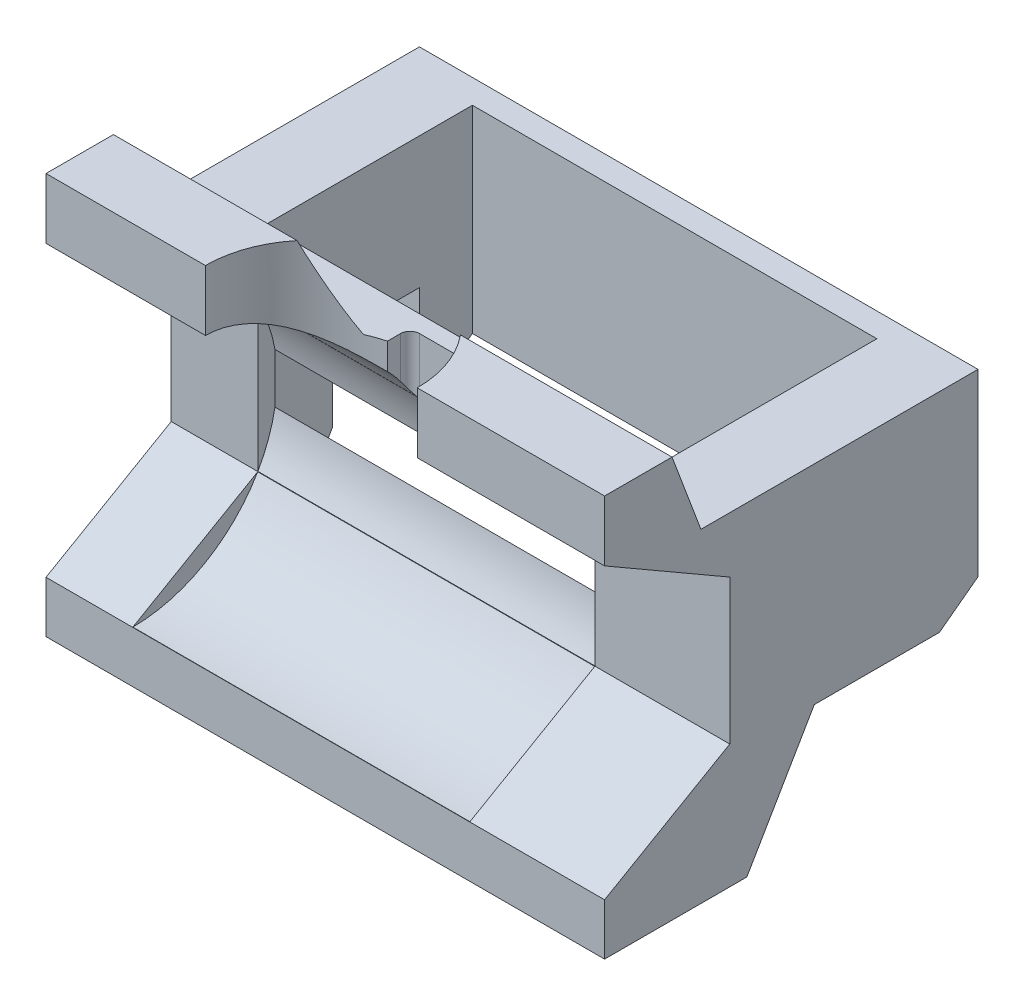
from build123d import *

# Parameters (mm, degrees)
SKETCH1_W               = 58
SKETCH1_H               = 38.77382393
SKETCH1_W_2             = 42
SKETCH1_H_2             = 21.5
BOSS_EXTRUDE2_DEPTH     = 33.65
CUT_EXTRUDE3_DEPTH      = 69.21502767
SKETCH7_W               = 4
SKETCH7_H               = 9
CUT_EXTRUDE4_DEPTH      = 8
BOSS_EXTRUDE3_DEPTH     = 58
CUT_EXTRUDE5_DEPTH      = 69.21502767
SKETCH10_W              = 5.5
SKETCH10_H              = 7
CUT_EXTRUDE6_DEPTH      = 15
FILLET1_R               = 1
CUT_EXTRUDE7_DEPTH      = 15
CUT_EXTRUDE7_DEPTH_BACK = 20
SKETCH11_R              = 15


with BuildPart() as part:
    # Sketch1 → Boss-Extrude2 (new body)
    with BuildSketch(Plane(origin=(0, -25, 0), x_dir=(1, 0, 0), z_dir=(0, 1, 0))):
        with Locations((0, -6.386911965)):
            Rectangle(SKETCH1_W, SKETCH1_H)
        with Locations((0, -0.25)):
            Rectangle(SKETCH1_W_2, SKETCH1_H_2, mode=Mode.SUBTRACT)
    extrude(amount=BOSS_EXTRUDE2_DEPTH)

    # Sketch6 → Cut-Extrude3 (cut, through all)
    with BuildSketch(Plane(origin=(29, 0, 0), x_dir=(0, 0, -1), z_dir=(1, 0, 0))):
        Polygon((-11, -25), (-4, -13), (9, -13), (13, -10), (13, -25), align=None)
    extrude(amount=-CUT_EXTRUDE3_DEPTH, mode=Mode.SUBTRACT)

    # Sketch7 → Cut-Extrude4 (cut)
    with BuildSketch(Plane.XZ.offset(13)):
        with Locations((-23, -0.5)):
            Rectangle(SKETCH7_W, SKETCH7_H)
    extrude(amount=-CUT_EXTRUDE4_DEPTH, mode=Mode.SUBTRACT)

    # Sketch9 → Boss-Extrude3 (add)
    with BuildSketch(Plane.ZY.offset(29)):
        Polygon((15.77382393, 8.65), (18.77382393, 16.65), (25.77382393, 16.65), (25.77382393, 8.65), align=None)
    extrude(amount=-BOSS_EXTRUDE3_DEPTH)

    # Sketch8 → Cut-Extrude5 (cut, through all)
    with BuildSketch(Plane.ZY.offset(29)):
        Polygon((25.77382393, 10.361106999), (12.77382393, 2.855553499), (12.77382393, -12.155553499), (25.77382393, -19.661106999), (38.77382393, -12.155553499), (38.77382393, 2.855553499), align=None)
    extrude(amount=-CUT_EXTRUDE5_DEPTH, mode=Mode.SUBTRACT)

    # Sketch10 → Cut-Extrude6 (cut)
    with BuildSketch(Plane(origin=(0, 16.65, 0), x_dir=(1, 0, 0), z_dir=(0, 1, 0))):
        with BuildLine():
            Line((-4.2, -12.77382393), (-4.2, -15.123119728))
            ThreePointArc((-4.2, -15.123119728), (-1.45, -14.77382393), (1.3, -15.123119728))
            Line((1.3, -15.123119728), (1.3, -12.77382393))
            Line((1.3, -12.77382393), (-4.2, -12.77382393))
        make_face()
        with BuildLine():
            Line((1.3, -18.77382393), (1.3, -25.77382393))
            Line((1.3, -25.77382393), (9.55, -25.77382393))
            ThreePointArc((9.55, -25.77382393), (8.90224843, -22.054825081), (7.035281374, -18.77382393))
            Line((7.035281374, -18.77382393), (1.3, -18.77382393))
        make_face()
        with BuildLine():
            Line((1.3, -15.123119728), (1.3, -18.77382393))
            Line((1.3, -18.77382393), (7.035281374, -18.77382393))
            ThreePointArc((7.035281374, -18.77382393), (4.456758602, -16.4942656), (1.3, -15.123119728))
        make_face()
        with BuildLine():
            Line((-4.2, -15.123119728), (-4.2, -18.77382393))
            Line((-4.2, -18.77382393), (1.3, -18.77382393))
            Line((1.3, -18.77382393), (1.3, -15.123119728))
            ThreePointArc((1.3, -15.123119728), (-1.45, -14.77382393), (-4.2, -15.123119728))
        make_face()
        with BuildLine():
            Line((-12.45, -25.77382393), (-4.2, -25.77382393))
            Line((-4.2, -25.77382393), (-4.2, -18.77382393))
            Line((-4.2, -18.77382393), (-9.935281374, -18.77382393))
            ThreePointArc((-9.935281374, -18.77382393), (-11.80224843, -22.054825081), (-12.45, -25.77382393))
        make_face()
        with Locations((-1.45, -22.27382393)):
            Rectangle(SKETCH10_W, SKETCH10_H)
        with BuildLine():
            Line((-9.935281374, -18.77382393), (-4.2, -18.77382393))
            Line((-4.2, -18.77382393), (-4.2, -15.123119728))
            ThreePointArc((-4.2, -15.123119728), (-7.356758602, -16.4942656), (-9.935281374, -18.77382393))
        make_face()
    extrude(amount=-CUT_EXTRUDE6_DEPTH, mode=Mode.SUBTRACT)

    # Fillet1
    fillet1_edges = [part.edges().sort_by_distance(p)[0] for p in [
        (-4.2, 5.75277675, 12.77382393),
        (1.3, 5.75277675, 12.77382393),
    ]]
    fillet(fillet1_edges, radius=FILLET1_R)

    # Sketch11 → Cut-Extrude7 (cut, two sides: drawn at the far end of the back side and taken through both)
    with BuildSketch(Plane(origin=(0, 0, 0), x_dir=(0, 0, -1), z_dir=(1, 0, 0)).offset(-CUT_EXTRUDE7_DEPTH_BACK)):
        with Locations((-25.77382393, -4.65)):
            Circle(SKETCH11_R)
    extrude(amount=CUT_EXTRUDE7_DEPTH + CUT_EXTRUDE7_DEPTH_BACK, mode=Mode.SUBTRACT)


solid = part.part
